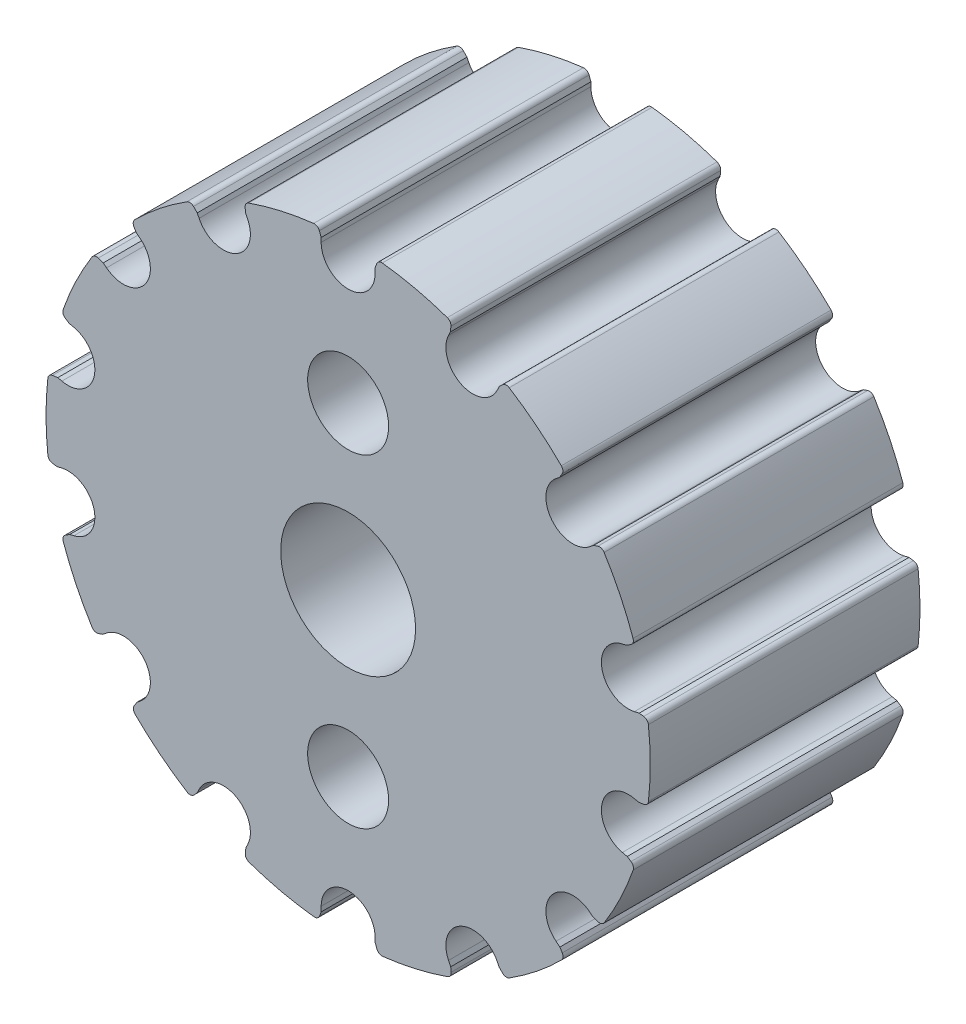
from build123d import *

# Parameters (mm, degrees)
SKETCH_1_R          = 2.5
SKETCH_1_R_2        = 1.5
EXTRUDE_1_DEPTH     = 10
FILLET_1_R          = 0.2
CUT_EXTRUDE_1_DEPTH = 10


with BuildPart() as part:
    # Эскиз1 → Вытянуть1 (new body)
    with BuildSketch(Plane.XY):
        with BuildLine():
            Line((-0.685932761, 9.95), (0, 9.95))
            Line((0, 9.95), (0.676, 9.95))
            Line((0.676, 9.95), (1.110862137, 11.144773901))
            ThreePointArc((1.110862137, 11.144773901), (2.487539236, 10.920263209), (3.825633205, 10.526373097))
            Line((3.825633205, 10.526373097), (3.699139141, 9.262255307))
            Line((3.699139141, 9.262255307), (4.317143204, 8.964640236))
            Line((4.317143204, 8.964640236), (4.926198159, 8.671334828))
            Line((4.926198159, 8.671334828), (5.836388374, 9.559109307))
            ThreePointArc((5.836388374, 9.559109307), (6.979320043, 8.759514355), (8.013998536, 7.824054413))
            Line((8.013998536, 7.824054413), (7.351551169, 6.740007356))
            Line((7.351551169, 6.740007356), (7.779223251, 6.203723528))
            Line((7.779223251, 6.203723528), (8.200702357, 5.675205446))
            Line((8.200702357, 5.675205446), (9.405946315, 6.08014588))
            ThreePointArc((9.405946315, 6.08014588), (10.088760919, 4.863836255), (10.615093172, 3.572085797))
            Line((10.615093172, 3.572085797), (9.547898328, 2.882818288))
            Line((9.547898328, 2.882818288), (9.700532726, 2.214083293))
            Line((9.700532726, 2.214083293), (9.850956878, 1.555032024))
            Line((9.850956878, 1.555032024), (11.112541232, 1.396934994))
            ThreePointArc((11.112541232, 1.396934994), (11.199998965, 0.004815734), (11.11373842, -1.38737822))
            Line((11.11373842, -1.38737822), (9.853167125, -1.545348298))
            Line((9.853167125, -1.545348298), (9.700532726, -2.214083293))
            Line((9.700532726, -2.214083293), (9.550108575, -2.873134562))
            Line((9.550108575, -2.873134562), (10.618161071, -3.562956001))
            ThreePointArc((10.618161071, -3.562956001), (10.092939856, -4.855158602), (9.411171473, -6.072054966))
            Line((9.411171473, -6.072054966), (8.206895332, -5.667439701))
            Line((8.206895332, -5.667439701), (7.779223251, -6.203723528))
            Line((7.779223251, -6.203723528), (7.357744145, -6.732241611))
            Line((7.357744145, -6.732241611), (8.020723888, -7.817159863))
            ThreePointArc((8.020723888, -7.817159863), (6.986850228, -8.753509233), (5.844606595, -9.554086756))
            Line((5.844606595, -9.554086756), (4.935147268, -8.667025164))
            Line((4.935147268, -8.667025164), (4.317143204, -8.964640236))
            Line((4.317143204, -8.964640236), (3.70808825, -9.257945643))
            Line((3.70808825, -9.257945643), (3.83468397, -10.523079343))
            ThreePointArc((3.83468397, -10.523079343), (2.496929223, -10.918120005), (1.120445701, -11.143814492))
            Line((1.120445701, -11.143814492), (0.685932761, -9.95))
            Line((0.685932761, -9.95), (0, -9.95))
            Line((0, -9.95), (-0.676, -9.95))
            Line((-0.676, -9.95), (-1.110862137, -11.144773901))
            ThreePointArc((-1.110862137, -11.144773901), (-2.487539236, -10.920263209), (-3.825633205, -10.526373097))
            Line((-3.825633205, -10.526373097), (-3.699139141, -9.262255307))
            Line((-3.699139141, -9.262255307), (-4.317143204, -8.964640236))
            Line((-4.317143204, -8.964640236), (-4.926198159, -8.671334828))
            Line((-4.926198159, -8.671334828), (-5.836388374, -9.559109307))
            ThreePointArc((-5.836388374, -9.559109307), (-6.979320043, -8.759514355), (-8.013998536, -7.824054413))
            Line((-8.013998536, -7.824054413), (-7.351551169, -6.740007356))
            Line((-7.351551169, -6.740007356), (-7.779223251, -6.203723528))
            Line((-7.779223251, -6.203723528), (-8.200702357, -5.675205446))
            Line((-8.200702357, -5.675205446), (-9.405946315, -6.08014588))
            ThreePointArc((-9.405946315, -6.08014588), (-10.088760919, -4.863836255), (-10.615093172, -3.572085797))
            Line((-10.615093172, -3.572085797), (-9.547898328, -2.882818288))
            Line((-9.547898328, -2.882818288), (-9.700532726, -2.214083293))
            Line((-9.700532726, -2.214083293), (-9.850956878, -1.555032024))
            Line((-9.850956878, -1.555032024), (-11.112541232, -1.396934994))
            ThreePointArc((-11.112541232, -1.396934994), (-11.199998965, -0.004815734), (-11.11373842, 1.38737822))
            Line((-11.11373842, 1.38737822), (-9.853167125, 1.545348298))
            Line((-9.853167125, 1.545348298), (-9.700532726, 2.214083293))
            Line((-9.700532726, 2.214083293), (-9.550108575, 2.873134562))
            Line((-9.550108575, 2.873134562), (-10.618161071, 3.562956001))
            ThreePointArc((-10.618161071, 3.562956001), (-10.092939856, 4.855158602), (-9.411171473, 6.072054966))
            Line((-9.411171473, 6.072054966), (-8.206895332, 5.667439701))
            Line((-8.206895332, 5.667439701), (-7.779223251, 6.203723528))
            Line((-7.779223251, 6.203723528), (-7.357744145, 6.732241611))
            Line((-7.357744145, 6.732241611), (-8.020723888, 7.817159863))
            ThreePointArc((-8.020723888, 7.817159863), (-6.986850228, 8.753509233), (-5.844606595, 9.554086756))
            Line((-5.844606595, 9.554086756), (-4.935147268, 8.667025164))
            Line((-4.935147268, 8.667025164), (-4.317143204, 8.964640236))
            Line((-4.317143204, 8.964640236), (-3.70808825, 9.257945643))
            Line((-3.70808825, 9.257945643), (-3.83468397, 10.523079343))
            ThreePointArc((-3.83468397, 10.523079343), (-2.496929223, 10.918120005), (-1.120445701, 11.143814492))
            Line((-1.120445701, 11.143814492), (-0.685932761, 9.95))
        make_face()
        Circle(SKETCH_1_R, mode=Mode.SUBTRACT)
        with Locations((0, 6)):
            Circle(SKETCH_1_R_2, mode=Mode.SUBTRACT)
        with Locations((0, -6)):
            Circle(SKETCH_1_R_2, mode=Mode.SUBTRACT)
    extrude(amount=EXTRUDE_1_DEPTH)

    # Скругление1
    fillet_1_edges = [part.edges().sort_by_distance(p)[0] for p in [
        (9.547898328, 2.882818288, 5),
        (9.850956878, 1.555032024, 5),
        (11.112541232, 1.396934994, 5),
        (11.11373842, -1.38737822, 5),
        (9.853167125, -1.545348298, 5),
        (9.550108575, -2.873134562, 5),
        (10.618161071, -3.562956001, 5),
        (9.411171473, -6.072054966, 5),
        (8.206895332, -5.667439701, 5),
        (7.357744145, -6.732241611, 5),
        (8.020723888, -7.817159863, 5),
        (5.844606595, -9.554086756, 5),
        (4.935147268, -8.667025164, 5),
        (3.70808825, -9.257945643, 5),
        (3.83468397, -10.523079343, 5),
        (1.120445701, -11.143814492, 5),
        (0.685932761, -9.95, 5),
        (-0.676, -9.95, 5),
        (-1.110862137, -11.144773901, 5),
        (-3.825633205, -10.526373097, 5),
        (-3.699139141, -9.262255307, 5),
        (-4.926198159, -8.671334828, 5),
        (-5.836388374, -9.559109307, 5),
        (-8.013998536, -7.824054413, 5),
        (-7.351551169, -6.740007356, 5),
        (-8.200702357, -5.675205446, 5),
        (-9.405946315, -6.08014588, 5),
        (-10.615093172, -3.572085797, 5),
        (-9.547898328, -2.882818288, 5),
        (-9.850956878, -1.555032024, 5),
        (-11.112541232, -1.396934994, 5),
        (-11.11373842, 1.38737822, 5),
        (-9.853167125, 1.545348298, 5),
        (-10.618161071, 3.562956001, 5),
        (-9.411171473, 6.072054966, 5),
        (-8.206895332, 5.667439701, 5),
        (-7.357744145, 6.732241611, 5),
        (-8.020723888, 7.817159863, 5),
        (-5.844606595, 9.554086756, 5),
        (-4.935147268, 8.667025164, 5),
        (-3.70808825, 9.257945643, 5),
        (-3.83468397, 10.523079343, 5),
        (-1.120445701, 11.143814492, 5),
        (-0.685932761, 9.95, 5),
        (0.676, 9.95, 5),
        (1.110862137, 11.144773901, 5),
        (3.825633205, 10.526373097, 5),
        (3.699139141, 9.262255307, 5),
        (4.926198159, 8.671334828, 5),
        (5.836388374, 9.559109307, 5),
        (8.013998536, 7.824054413, 5),
        (7.351551169, 6.740007356, 5),
        (8.200702357, 5.675205446, 5),
        (9.405946315, 6.08014588, 5),
        (10.615093172, 3.572085797, 5),
    ]]
    fillet(fillet_1_edges, radius=FILLET_1_R)

    # Эскиз2 → Вырез-Вытянуть1 (cut)
    with BuildSketch(Plane.XY.offset(10)):
        with BuildLine():
            Line((4.740104239, 12.147692744), (6.542041974, 11.279925266))
            Line((6.542041974, 11.279925266), (5.524607217, 9.167200224))
            ThreePointArc((5.524607217, 9.167200224), (4.18975461, 8.700115095), (3.722669482, 10.034967702))
            Line((3.722669482, 10.034967702), (4.740104239, 12.147692744))
        make_face()
        with BuildLine():
            Line((-1, 13.00134713), (1, 13.00134713))
            Line((1, 13.00134713), (1, 10.656399244))
            ThreePointArc((1, 10.656399244), (0, 9.656399244), (-1, 10.656399244))
            Line((-1, 10.656399244), (-1, 13.00134713))
        make_face()
        with BuildLine():
            Line((9.541372699, 8.888038829), (10.788352303, 7.324375864))
            Line((10.788352303, 7.324375864), (8.95499822, 5.862324771))
            ThreePointArc((8.95499822, 5.862324771), (7.549676936, 6.020666451), (7.708018617, 7.425987736))
            Line((7.708018617, 7.425987736), (9.541372699, 8.888038829))
        make_face()
        with BuildLine():
            Line((12.45285528, 3.867999818), (12.897897147, 1.918143994))
            Line((12.897897147, 1.918143994), (10.611742, 1.396344))
            ThreePointArc((10.611742, 1.396344), (9.414293154, 2.148750978), (10.166700132, 3.346199825))
            Line((10.166700132, 3.346199825), (12.45285528, 3.867999818))
        make_face()
        with BuildLine():
            Line((12.897897147, -1.918143994), (12.45285528, -3.867999818))
            Line((12.45285528, -3.867999818), (10.166700132, -3.346199825))
            ThreePointArc((10.166700132, -3.346199825), (9.414293154, -2.148750978), (10.611742, -1.396344))
            Line((10.611742, -1.396344), (12.897897147, -1.918143994))
        make_face()
        with BuildLine():
            Line((10.788352303, -7.324375864), (9.541372699, -8.888038829))
            Line((9.541372699, -8.888038829), (7.708018617, -7.425987736))
            ThreePointArc((7.708018617, -7.425987736), (7.549676936, -6.020666451), (8.95499822, -5.862324771))
            Line((8.95499822, -5.862324771), (10.788352303, -7.324375864))
        make_face()
        with BuildLine():
            Line((6.542041974, -11.279925266), (4.740104239, -12.147692744))
            Line((4.740104239, -12.147692744), (3.722669482, -10.034967702))
            ThreePointArc((3.722669482, -10.034967702), (4.18975461, -8.700115095), (5.524607217, -9.167200224))
            Line((5.524607217, -9.167200224), (6.542041974, -11.279925266))
        make_face()
        with BuildLine():
            Line((1, -13.00134713), (-1, -13.00134713))
            Line((-1, -13.00134713), (-1, -10.656399244))
            ThreePointArc((-1, -10.656399244), (0, -9.656399244), (1, -10.656399244))
            Line((1, -10.656399244), (1, -13.00134713))
        make_face()
        with BuildLine():
            Line((-4.740104239, -12.147692744), (-6.542041974, -11.279925266))
            Line((-6.542041974, -11.279925266), (-5.524607217, -9.167200224))
            ThreePointArc((-5.524607217, -9.167200224), (-4.18975461, -8.700115095), (-3.722669482, -10.034967702))
            Line((-3.722669482, -10.034967702), (-4.740104239, -12.147692744))
        make_face()
        with BuildLine():
            Line((-9.541372699, -8.888038829), (-10.788352303, -7.324375864))
            Line((-10.788352303, -7.324375864), (-8.95499822, -5.862324771))
            ThreePointArc((-8.95499822, -5.862324771), (-7.549676936, -6.020666451), (-7.708018617, -7.425987736))
            Line((-7.708018617, -7.425987736), (-9.541372699, -8.888038829))
        make_face()
        with BuildLine():
            Line((-12.452855279, -3.867999818), (-12.897897147, -1.918143994))
            Line((-12.897897147, -1.918143994), (-10.611742, -1.396344))
            ThreePointArc((-10.611742, -1.396344), (-9.414293154, -2.148750978), (-10.166700132, -3.346199825))
            Line((-10.166700132, -3.346199825), (-12.452855279, -3.867999818))
        make_face()
        with BuildLine():
            Line((-12.897897147, 1.918143994), (-12.45285528, 3.867999818))
            Line((-12.45285528, 3.867999818), (-10.166700132, 3.346199825))
            ThreePointArc((-10.166700132, 3.346199825), (-9.414293154, 2.148750978), (-10.611742, 1.396344))
            Line((-10.611742, 1.396344), (-12.897897147, 1.918143994))
        make_face()
        with BuildLine():
            Line((-10.788352303, 7.324375864), (-9.541372699, 8.888038829))
            Line((-9.541372699, 8.888038829), (-7.708018617, 7.425987736))
            ThreePointArc((-7.708018617, 7.425987736), (-7.549676936, 6.020666451), (-8.95499822, 5.862324771))
            Line((-8.95499822, 5.862324771), (-10.788352303, 7.324375864))
        make_face()
        with BuildLine():
            Line((-6.542041974, 11.279925266), (-4.740104239, 12.147692744))
            Line((-4.740104239, 12.147692744), (-3.722669482, 10.034967702))
            ThreePointArc((-3.722669482, 10.034967702), (-4.18975461, 8.700115095), (-5.524607217, 9.167200224))
            Line((-5.524607217, 9.167200224), (-6.542041974, 11.279925266))
        make_face()
    extrude(amount=-CUT_EXTRUDE_1_DEPTH, mode=Mode.SUBTRACT)


solid = part.part
